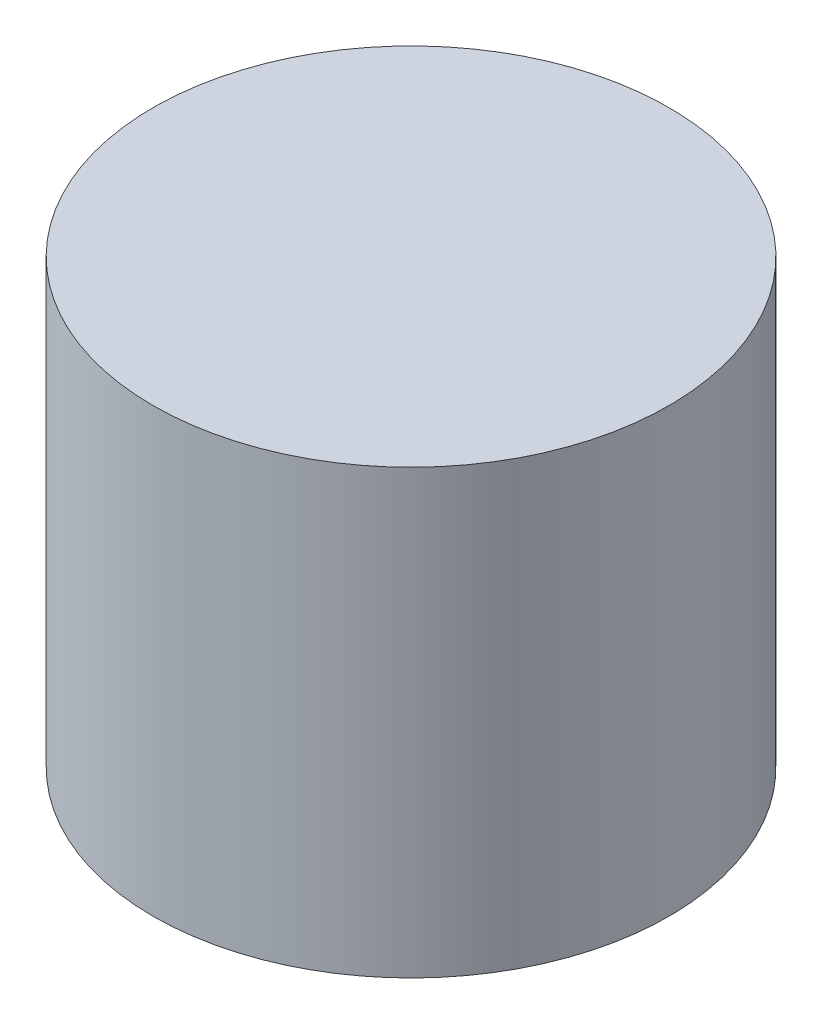
from build123d import *

# Parameters (mm, degrees)
SKETCH1_R           = 3.5
BOSS_EXTRUDE1_DEPTH = 6


with BuildPart() as part:
    # Sketch1 → Boss-Extrude1 (new body)
    with BuildSketch(Plane(origin=(0, 0, 0), x_dir=(1, 0, 0), z_dir=(0, 1, 0))):
        with Locations(Location((0, 0, 0), (0, 0, 270))):
            Circle(SKETCH1_R)
    extrude(amount=BOSS_EXTRUDE1_DEPTH)


solid = part.part
